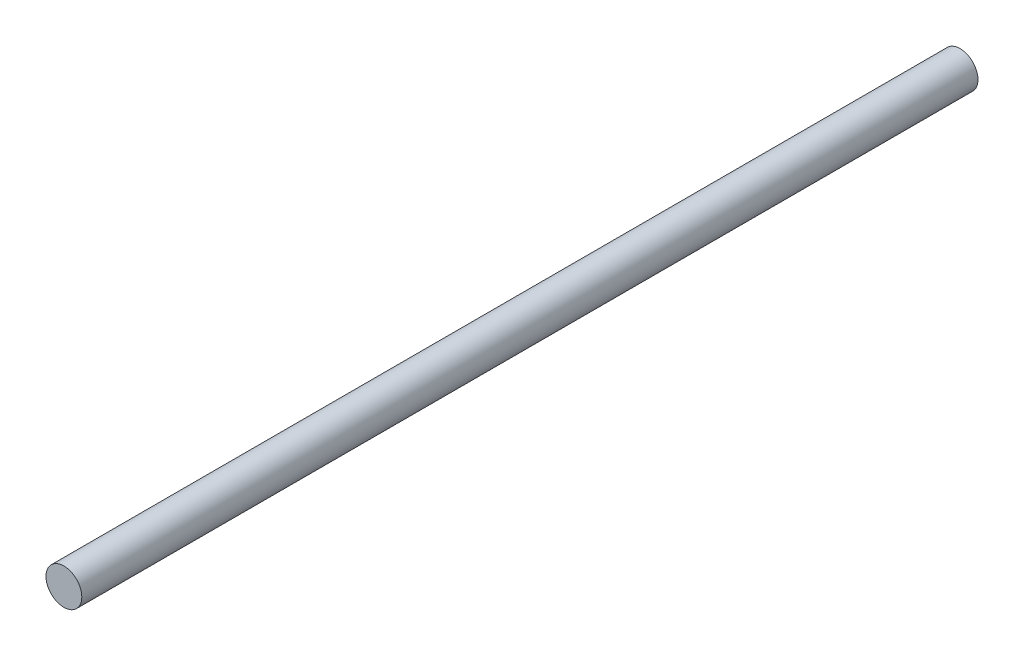
from build123d import *

# Parameters (mm, degrees)
SKETCH2_R           = 4
BOSS_EXTRUDE1_DEPTH = 100


with BuildPart() as part:
    # Sketch2 → Boss-Extrude1 (new, symmetric)
    with BuildSketch(Plane.XY):
        Circle(SKETCH2_R)
    extrude(amount=BOSS_EXTRUDE1_DEPTH, both=True)


solid = part.part
